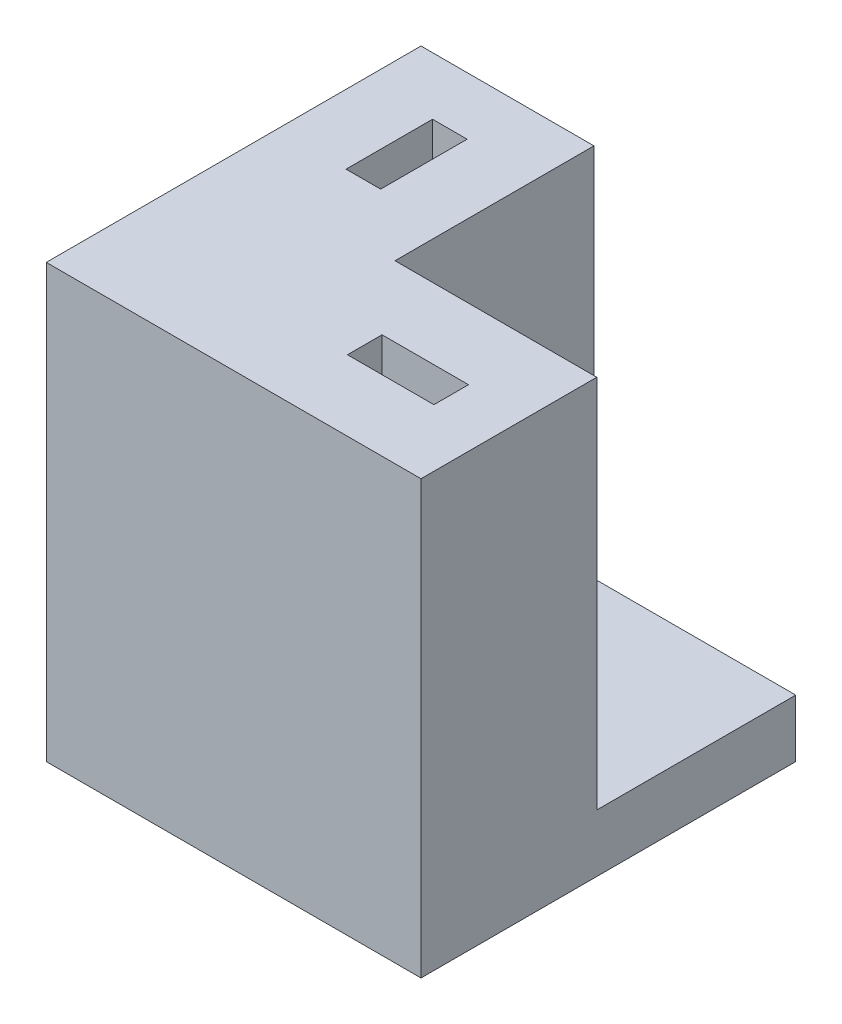
from build123d import *

# Parameters (mm, degrees)
SKETCH3_W           = 16.51
SKETCH3_H           = 16.51
BOSS_EXTRUDE2_DEPTH = 19.05
SKETCH5_R           = 2.54
CUT_EXTRUDE2_DEPTH  = 5.715
SKETCH6_W           = 8.89
SKETCH6_H           = 8.765916865
CUT_EXTRUDE3_DEPTH  = 16.51
SKETCH7_W           = 1.524
SKETCH7_H           = 3.81
SKETCH7_W_2         = 3.81
SKETCH7_H_2         = 1.524
CUT_EXTRUDE4_DEPTH  = 2.54


with BuildPart() as part:
    # Sketch3 → Boss-Extrude2 (new body)
    with BuildSketch(Plane(origin=(0, 0, 0), x_dir=(1, 0, 0), z_dir=(0, 1, 0))):
        Rectangle(SKETCH3_W, SKETCH3_H)
    extrude(amount=BOSS_EXTRUDE2_DEPTH)

    # Sketch5 → Cut-Extrude2 (cut)
    with BuildSketch(Plane.XZ):
        with Locations(Location((-4.1275, 4.1275, 0), (0, 0, 270))):
            Circle(SKETCH5_R)
    extrude(amount=-CUT_EXTRUDE2_DEPTH, mode=Mode.SUBTRACT)

    # Sketch6 → Cut-Extrude3 (cut)
    with BuildSketch(Plane(origin=(0, 19.05, 0), x_dir=(1, 0, 0), z_dir=(0, 1, 0))):
        with Locations((3.81, 3.872041568)):
            Rectangle(SKETCH6_W, SKETCH6_H)
    extrude(amount=-CUT_EXTRUDE3_DEPTH, mode=Mode.SUBTRACT)

    # Sketch7 → Cut-Extrude4 (cut)
    with BuildSketch(Plane(origin=(0, 19.05, 0), x_dir=(1, 0, 0), z_dir=(0, 1, 0))):
        with Locations((-4.445, 3.81)):
            Rectangle(SKETCH7_W, SKETCH7_H)
        with Locations((3.81, -4.382958433)):
            Rectangle(SKETCH7_W_2, SKETCH7_H_2)
    extrude(amount=-CUT_EXTRUDE4_DEPTH, mode=Mode.SUBTRACT)


solid = part.part
